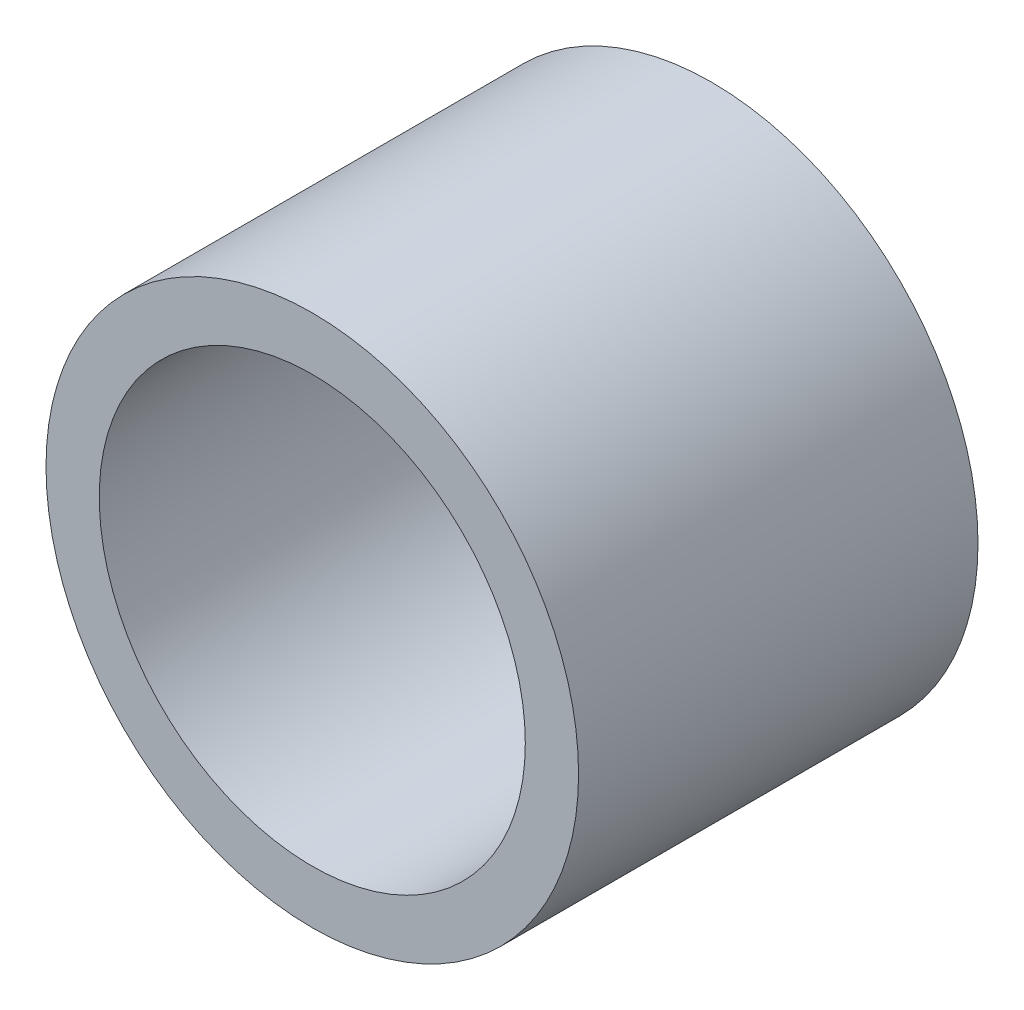
from build123d import *

# Parameters (mm, degrees)
SKETCH1_R           = 10
SKETCH1_R_2         = 8
BOSS_EXTRUDE1_DEPTH = 15


with BuildPart() as part:
    # Sketch1 → Boss-Extrude1 (new body)
    with BuildSketch(Plane.XY):
        Circle(SKETCH1_R)
        Circle(SKETCH1_R_2, mode=Mode.SUBTRACT)
    extrude(amount=BOSS_EXTRUDE1_DEPTH)


solid = part.part
